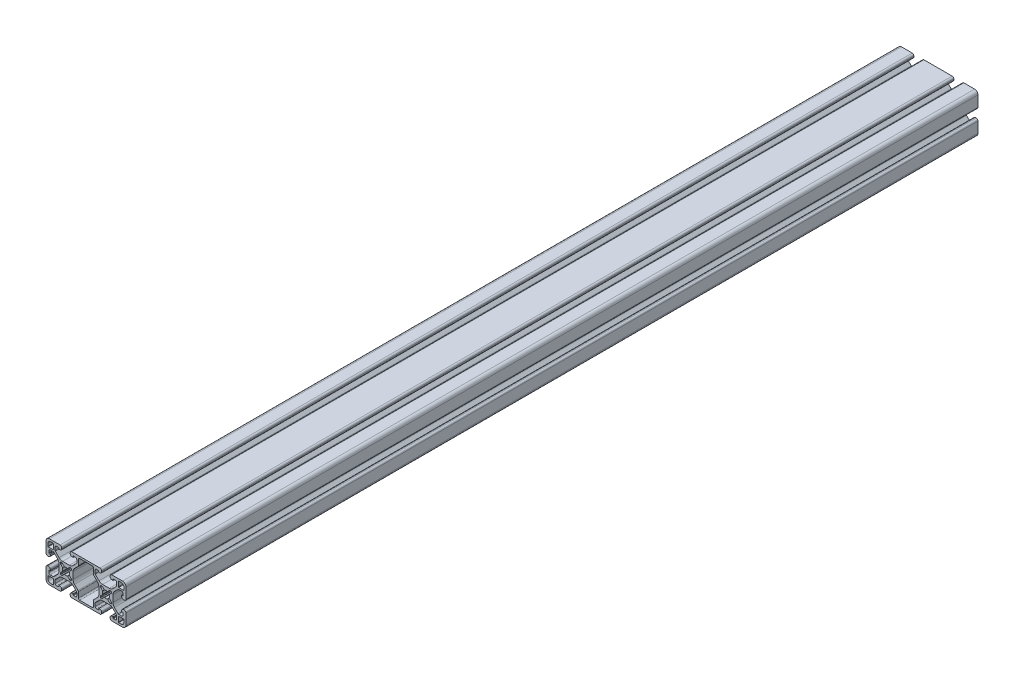
from build123d import *

# Parameters (mm, degrees)
EXTRUDE1_DEPTH     = 812.8
SKETCH2_R          = 3.75666
CUT_EXTRUDE1_DEPTH = 815.58397971


with BuildPart() as part:
    # Sketch1 → Extrude1 (new body)
    with BuildSketch(Plane.XY):
        with BuildLine():
            Line((35.335872595, -7.239), (35.335872595, -9.017))
            ThreePointArc((35.335872595, -9.017), (34.963898208, -9.915025612), (34.065872595, -10.287))
            Line((34.065872595, -10.287), (31.267800422, -10.287))
            ThreePointArc((31.267800422, -10.287), (30.927594851, -10.219328904), (30.639182494, -10.026617928))
            Line((30.639182494, -10.026617928), (27.179198975, -6.56663441))
            ThreePointArc((27.179198975, -6.56663441), (26.14957176, -5.025688387), (25.788014764, -3.20801862))
            Line((25.788014764, -3.20801862), (25.788014764, 3.20801862))
            ThreePointArc((25.788014764, 3.20801862), (26.14957176, 5.025688387), (27.179198975, 6.56663441))
            Line((27.179198975, 6.56663441), (30.639182494, 10.026617928))
            ThreePointArc((30.639182494, 10.026617928), (30.927594851, 10.219328904), (31.267800422, 10.287))
            Line((31.267800422, 10.287), (34.065872595, 10.287))
            ThreePointArc((34.065872595, 10.287), (34.963898208, 9.915025612), (35.335872595, 9.017))
            Line((35.335872595, 9.017), (35.335872595, 7.239))
            ThreePointArc((35.335872595, 7.239), (35.224280279, 6.969592316), (34.954872595, 6.858))
            Line((34.954872595, 6.858), (34.036, 6.858))
            Line((34.036, 6.858), (34.036, 5.6388))
            ThreePointArc((34.036, 5.6388), (34.497248241, 4.525248241), (35.6108, 4.064))
            Line((35.6108, 4.064), (36.5252, 4.064))
            ThreePointArc((36.5252, 4.064), (37.638751759, 4.525248241), (38.1, 5.6388))
            Line((38.1, 5.6388), (38.1, 15.875))
            ThreePointArc((38.1, 15.875), (37.17006403, 18.12006403), (34.925, 19.05))
            Line((34.925, 19.05), (24.6888, 19.05))
            ThreePointArc((24.6888, 19.05), (23.575248241, 18.588751759), (23.114, 17.4752))
            Line((23.114, 17.4752), (23.114, 16.5608))
            ThreePointArc((23.114, 16.5608), (23.575248241, 15.447248241), (24.6888, 14.986))
            Line((24.6888, 14.986), (25.908, 14.986))
            Line((25.908, 14.986), (25.908, 15.904872595))
            ThreePointArc((25.908, 15.904872595), (26.019592316, 16.174280279), (26.289, 16.285872595))
            Line((26.289, 16.285872595), (28.067, 16.285872595))
            ThreePointArc((28.067, 16.285872595), (28.965025612, 15.913898208), (29.337, 15.015872595))
            Line((29.337, 15.015872595), (29.337, 12.217800422))
            ThreePointArc((29.337, 12.217800422), (29.269328904, 11.877594851), (29.076617928, 11.589182494))
            Line((29.076617928, 11.589182494), (25.61663441, 8.129198975))
            ThreePointArc((25.61663441, 8.129198975), (24.075688387, 7.09957176), (22.25801862, 6.738014764))
            Line((22.25801862, 6.738014764), (15.84198138, 6.738014764))
            ThreePointArc((15.84198138, 6.738014764), (14.024311613, 7.09957176), (12.48336559, 8.129198975))
            Line((12.48336559, 8.129198975), (9.023382072, 11.589182494))
            ThreePointArc((9.023382072, 11.589182494), (8.830671096, 11.877594851), (8.763, 12.217800422))
            Line((8.763, 12.217800422), (8.763, 15.015872595))
            ThreePointArc((8.763, 15.015872595), (9.134974388, 15.913898208), (10.033, 16.285872595))
            Line((10.033, 16.285872595), (11.811, 16.285872595))
            ThreePointArc((11.811, 16.285872595), (12.080407684, 16.174280279), (12.192, 15.904872595))
            Line((12.192, 15.904872595), (12.192, 14.986))
            Line((12.192, 14.986), (13.4112, 14.986))
            ThreePointArc((13.4112, 14.986), (14.524751759, 15.447248241), (14.986, 16.5608))
            Line((14.986, 16.5608), (14.986, 17.4752))
            ThreePointArc((14.986, 17.4752), (14.524751759, 18.588751759), (13.4112, 19.05))
            Line((13.4112, 19.05), (-13.4112, 19.05))
            ThreePointArc((-13.4112, 19.05), (-14.524751759, 18.588751759), (-14.986, 17.4752))
            Line((-14.986, 17.4752), (-14.986, 16.5608))
            ThreePointArc((-14.986, 16.5608), (-14.524751759, 15.447248241), (-13.4112, 14.986))
            Line((-13.4112, 14.986), (-12.192, 14.986))
            Line((-12.192, 14.986), (-12.192, 15.904872595))
            ThreePointArc((-12.192, 15.904872595), (-12.080407684, 16.174280279), (-11.811, 16.285872595))
            Line((-11.811, 16.285872595), (-10.033, 16.285872595))
            ThreePointArc((-10.033, 16.285872595), (-9.134974388, 15.913898208), (-8.763, 15.015872595))
            Line((-8.763, 15.015872595), (-8.763, 12.217800422))
            ThreePointArc((-8.763, 12.217800422), (-8.830671096, 11.877594851), (-9.023382072, 11.589182494))
            Line((-9.023382072, 11.589182494), (-12.48336559, 8.129198975))
            ThreePointArc((-12.48336559, 8.129198975), (-14.024311613, 7.09957176), (-15.84198138, 6.738014764))
            Line((-15.84198138, 6.738014764), (-22.25801862, 6.738014764))
            ThreePointArc((-22.25801862, 6.738014764), (-24.075688387, 7.09957176), (-25.61663441, 8.129198975))
            Line((-25.61663441, 8.129198975), (-29.076617928, 11.589182494))
            ThreePointArc((-29.076617928, 11.589182494), (-29.269328904, 11.877594851), (-29.337, 12.217800422))
            Line((-29.337, 12.217800422), (-29.337, 15.015872595))
            ThreePointArc((-29.337, 15.015872595), (-28.965025612, 15.913898208), (-28.067, 16.285872595))
            Line((-28.067, 16.285872595), (-26.289, 16.285872595))
            ThreePointArc((-26.289, 16.285872595), (-26.019592316, 16.174280279), (-25.908, 15.904872595))
            Line((-25.908, 15.904872595), (-25.908, 14.986))
            Line((-25.908, 14.986), (-24.6888, 14.986))
            ThreePointArc((-24.6888, 14.986), (-23.575248241, 15.447248241), (-23.114, 16.5608))
            Line((-23.114, 16.5608), (-23.114, 17.4752))
            ThreePointArc((-23.114, 17.4752), (-23.575248241, 18.588751759), (-24.6888, 19.05))
            Line((-24.6888, 19.05), (-34.925, 19.05))
            ThreePointArc((-34.925, 19.05), (-37.17006403, 18.12006403), (-38.1, 15.875))
            Line((-38.1, 15.875), (-38.1, 5.6388))
            ThreePointArc((-38.1, 5.6388), (-37.638751759, 4.525248241), (-36.5252, 4.064))
            Line((-36.5252, 4.064), (-35.6108, 4.064))
            ThreePointArc((-35.6108, 4.064), (-34.497248241, 4.525248241), (-34.036, 5.6388))
            Line((-34.036, 5.6388), (-34.036, 6.858))
            Line((-34.036, 6.858), (-34.954872595, 6.858))
            ThreePointArc((-34.954872595, 6.858), (-35.224280279, 6.969592316), (-35.335872595, 7.239))
            Line((-35.335872595, 7.239), (-35.335872595, 9.017))
            ThreePointArc((-35.335872595, 9.017), (-34.963898208, 9.915025612), (-34.065872595, 10.287))
            Line((-34.065872595, 10.287), (-31.267800422, 10.287))
            ThreePointArc((-31.267800422, 10.287), (-30.927594851, 10.219328904), (-30.639182494, 10.026617928))
            Line((-30.639182494, 10.026617928), (-27.179198975, 6.56663441))
            ThreePointArc((-27.179198975, 6.56663441), (-26.14957176, 5.025688387), (-25.788014764, 3.20801862))
            Line((-25.788014764, 3.20801862), (-25.788014764, -3.20801862))
            ThreePointArc((-25.788014764, -3.20801862), (-26.14957176, -5.025688387), (-27.179198975, -6.56663441))
            Line((-27.179198975, -6.56663441), (-30.639182494, -10.026617928))
            ThreePointArc((-30.639182494, -10.026617928), (-30.927594851, -10.219328904), (-31.267800422, -10.287))
            Line((-31.267800422, -10.287), (-34.065872595, -10.287))
            ThreePointArc((-34.065872595, -10.287), (-34.963898208, -9.915025612), (-35.335872595, -9.017))
            Line((-35.335872595, -9.017), (-35.335872595, -7.239))
            ThreePointArc((-35.335872595, -7.239), (-35.224280279, -6.969592316), (-34.954872595, -6.858))
            Line((-34.954872595, -6.858), (-34.036, -6.858))
            Line((-34.036, -6.858), (-34.036, -5.6388))
            ThreePointArc((-34.036, -5.6388), (-34.497248241, -4.525248241), (-35.6108, -4.064))
            Line((-35.6108, -4.064), (-36.5252, -4.064))
            ThreePointArc((-36.5252, -4.064), (-37.638751759, -4.525248241), (-38.1, -5.6388))
            Line((-38.1, -5.6388), (-38.1, -15.875))
            ThreePointArc((-38.1, -15.875), (-37.17006403, -18.12006403), (-34.925, -19.05))
            Line((-34.925, -19.05), (-24.6888, -19.05))
            ThreePointArc((-24.6888, -19.05), (-23.575248241, -18.588751759), (-23.114, -17.4752))
            Line((-23.114, -17.4752), (-23.114, -16.5608))
            ThreePointArc((-23.114, -16.5608), (-23.575248241, -15.447248241), (-24.6888, -14.986))
            Line((-24.6888, -14.986), (-25.908, -14.986))
            Line((-25.908, -14.986), (-25.908, -15.904872595))
            ThreePointArc((-25.908, -15.904872595), (-26.019592316, -16.174280279), (-26.289, -16.285872595))
            Line((-26.289, -16.285872595), (-28.067, -16.285872595))
            ThreePointArc((-28.067, -16.285872595), (-28.965025612, -15.913898208), (-29.337, -15.015872595))
            Line((-29.337, -15.015872595), (-29.337, -12.217800422))
            ThreePointArc((-29.337, -12.217800422), (-29.269328904, -11.877594851), (-29.076617928, -11.589182494))
            Line((-29.076617928, -11.589182494), (-25.61663441, -8.129198975))
            ThreePointArc((-25.61663441, -8.129198975), (-24.075688387, -7.09957176), (-22.25801862, -6.738014764))
            Line((-22.25801862, -6.738014764), (-15.84198138, -6.738014764))
            ThreePointArc((-15.84198138, -6.738014764), (-14.024311613, -7.09957176), (-12.48336559, -8.129198975))
            Line((-12.48336559, -8.129198975), (-9.023382072, -11.589182494))
            ThreePointArc((-9.023382072, -11.589182494), (-8.830671096, -11.877594851), (-8.763, -12.217800422))
            Line((-8.763, -12.217800422), (-8.763, -15.015872595))
            ThreePointArc((-8.763, -15.015872595), (-9.134974388, -15.913898208), (-10.033, -16.285872595))
            Line((-10.033, -16.285872595), (-11.811, -16.285872595))
            ThreePointArc((-11.811, -16.285872595), (-12.080407684, -16.174280279), (-12.192, -15.904872595))
            Line((-12.192, -15.904872595), (-12.192, -14.986))
            Line((-12.192, -14.986), (-13.4112, -14.986))
            ThreePointArc((-13.4112, -14.986), (-14.524751759, -15.447248241), (-14.986, -16.5608))
            Line((-14.986, -16.5608), (-14.986, -17.4752))
            ThreePointArc((-14.986, -17.4752), (-14.524751759, -18.588751759), (-13.4112, -19.05))
            Line((-13.4112, -19.05), (13.4112, -19.05))
            ThreePointArc((13.4112, -19.05), (14.524751759, -18.588751759), (14.986, -17.4752))
            Line((14.986, -17.4752), (14.986, -16.5608))
            ThreePointArc((14.986, -16.5608), (14.524751759, -15.447248241), (13.4112, -14.986))
            Line((13.4112, -14.986), (12.192, -14.986))
            Line((12.192, -14.986), (12.192, -15.904872595))
            ThreePointArc((12.192, -15.904872595), (12.080407684, -16.174280279), (11.811, -16.285872595))
            Line((11.811, -16.285872595), (10.033, -16.285872595))
            ThreePointArc((10.033, -16.285872595), (9.134974388, -15.913898208), (8.763, -15.015872595))
            Line((8.763, -15.015872595), (8.763, -12.217800422))
            ThreePointArc((8.763, -12.217800422), (8.830671096, -11.877594851), (9.023382072, -11.589182494))
            Line((9.023382072, -11.589182494), (12.48336559, -8.129198975))
            ThreePointArc((12.48336559, -8.129198975), (14.024311613, -7.09957176), (15.84198138, -6.738014764))
            Line((15.84198138, -6.738014764), (22.25801862, -6.738014764))
            ThreePointArc((22.25801862, -6.738014764), (24.075688387, -7.09957176), (25.61663441, -8.129198975))
            Line((25.61663441, -8.129198975), (29.076617928, -11.589182494))
            ThreePointArc((29.076617928, -11.589182494), (29.269328904, -11.877594851), (29.337, -12.217800422))
            Line((29.337, -12.217800422), (29.337, -15.015872595))
            ThreePointArc((29.337, -15.015872595), (28.965025612, -15.913898208), (28.067, -16.285872595))
            Line((28.067, -16.285872595), (26.289, -16.285872595))
            ThreePointArc((26.289, -16.285872595), (26.019592316, -16.174280279), (25.908, -15.904872595))
            Line((25.908, -15.904872595), (25.908, -14.986))
            Line((25.908, -14.986), (24.6888, -14.986))
            ThreePointArc((24.6888, -14.986), (23.575248241, -15.447248241), (23.114, -16.5608))
            Line((23.114, -16.5608), (23.114, -17.4752))
            ThreePointArc((23.114, -17.4752), (23.575248241, -18.588751759), (24.6888, -19.05))
            Line((24.6888, -19.05), (34.925, -19.05))
            ThreePointArc((34.925, -19.05), (37.17006403, -18.12006403), (38.1, -15.875))
            Line((38.1, -15.875), (38.1, -5.6388))
            ThreePointArc((38.1, -5.6388), (37.638751759, -4.525248241), (36.5252, -4.064))
            Line((36.5252, -4.064), (35.6108, -4.064))
            ThreePointArc((35.6108, -4.064), (34.497248241, -4.525248241), (34.036, -5.6388))
            Line((34.036, -5.6388), (34.036, -6.858))
            Line((34.036, -6.858), (34.954872595, -6.858))
            ThreePointArc((34.954872595, -6.858), (35.224280279, -6.969592316), (35.335872595, -7.239))
        make_face()
        with BuildLine():
            Line((-20.632347442, -3.198793543), (-22.354771827, -4.921217928))
            ThreePointArc((-22.354771827, -4.921217928), (-22.643184184, -5.113928904), (-22.983389755, -5.1816))
            Line((-22.983389755, -5.1816), (-23.9776, -5.1816))
            ThreePointArc((-23.9776, -5.1816), (-24.157205122, -5.107205122), (-24.2316, -4.9276))
            Line((-24.2316, -4.9276), (-24.2316, -3.933389755))
            ThreePointArc((-24.2316, -3.933389755), (-24.163928904, -3.593184184), (-23.971217928, -3.304771827))
            Line((-23.971217928, -3.304771827), (-22.248793543, -1.582347442))
            ThreePointArc((-22.248793543, -1.582347442), (-22.145711236, -1.393016011), (-22.161879183, -1.178048687))
            ThreePointArc((-22.161879183, -1.178048687), (-22.3774, 0), (-22.161879183, 1.178048687))
            ThreePointArc((-22.161879183, 1.178048687), (-22.145711236, 1.393016011), (-22.248793543, 1.582347442))
            Line((-22.248793543, 1.582347442), (-23.971217928, 3.304771827))
            ThreePointArc((-23.971217928, 3.304771827), (-24.163928904, 3.593184184), (-24.2316, 3.933389755))
            Line((-24.2316, 3.933389755), (-24.2316, 4.9276))
            ThreePointArc((-24.2316, 4.9276), (-24.157205122, 5.107205122), (-23.9776, 5.1816))
            Line((-23.9776, 5.1816), (-22.983389755, 5.1816))
            ThreePointArc((-22.983389755, 5.1816), (-22.643184184, 5.113928904), (-22.354771827, 4.921217928))
            Line((-22.354771827, 4.921217928), (-20.632347442, 3.198793543))
            ThreePointArc((-20.632347442, 3.198793543), (-20.443016011, 3.095711236), (-20.228048687, 3.111879183))
            ThreePointArc((-20.228048687, 3.111879183), (-19.05, 3.3274), (-17.871951313, 3.111879183))
            ThreePointArc((-17.871951313, 3.111879183), (-17.656983989, 3.095711236), (-17.467652558, 3.198793543))
            Line((-17.467652558, 3.198793543), (-15.745228173, 4.921217928))
            ThreePointArc((-15.745228173, 4.921217928), (-15.456815816, 5.113928904), (-15.116610245, 5.1816))
            Line((-15.116610245, 5.1816), (-14.1224, 5.1816))
            ThreePointArc((-14.1224, 5.1816), (-13.942794878, 5.107205122), (-13.8684, 4.9276))
            Line((-13.8684, 4.9276), (-13.8684, 3.933389755))
            ThreePointArc((-13.8684, 3.933389755), (-13.936071096, 3.593184184), (-14.128782072, 3.304771827))
            Line((-14.128782072, 3.304771827), (-15.851206457, 1.582347442))
            ThreePointArc((-15.851206457, 1.582347442), (-15.954288764, 1.393016011), (-15.938120817, 1.178048687))
            ThreePointArc((-15.938120817, 1.178048687), (-15.7226, 0), (-15.938120817, -1.178048687))
            ThreePointArc((-15.938120817, -1.178048687), (-15.954288764, -1.393016011), (-15.851206457, -1.582347442))
            Line((-15.851206457, -1.582347442), (-14.128782072, -3.304771827))
            ThreePointArc((-14.128782072, -3.304771827), (-13.936071096, -3.593184184), (-13.8684, -3.933389755))
            Line((-13.8684, -3.933389755), (-13.8684, -4.9276))
            ThreePointArc((-13.8684, -4.9276), (-13.942794878, -5.107205122), (-14.1224, -5.1816))
            Line((-14.1224, -5.1816), (-15.116610245, -5.1816))
            ThreePointArc((-15.116610245, -5.1816), (-15.456815816, -5.113928904), (-15.745228173, -4.921217928))
            Line((-15.745228173, -4.921217928), (-17.467652558, -3.198793543))
            ThreePointArc((-17.467652558, -3.198793543), (-17.656983989, -3.095711236), (-17.871951313, -3.111879183))
            ThreePointArc((-17.871951313, -3.111879183), (-19.05, -3.3274), (-20.228048687, -3.111879183))
            ThreePointArc((-20.228048687, -3.111879183), (-20.443016011, -3.095711236), (-20.632347442, -3.198793543))
        make_face(mode=Mode.SUBTRACT)
        with BuildLine():
            Line((30.9118, -16.8656), (30.9118, -12.2428))
            ThreePointArc((30.9118, -12.2428), (31.023392316, -11.973392316), (31.2928, -11.8618))
            Line((31.2928, -11.8618), (35.9156, -11.8618))
            ThreePointArc((35.9156, -11.8618), (36.185007684, -11.973392316), (36.2966, -12.2428))
            Line((36.2966, -12.2428), (36.2966, -14.4526))
            ThreePointArc((36.2966, -14.4526), (35.478256347, -16.428256347), (33.5026, -17.2466))
            Line((33.5026, -17.2466), (31.2928, -17.2466))
            ThreePointArc((31.2928, -17.2466), (31.023392316, -17.135007684), (30.9118, -16.8656))
        make_face(mode=Mode.SUBTRACT)
        with BuildLine():
            Line((35.9156, 11.8618), (31.2928, 11.8618))
            ThreePointArc((31.2928, 11.8618), (31.023392316, 11.973392316), (30.9118, 12.2428))
            Line((30.9118, 12.2428), (30.9118, 16.8656))
            ThreePointArc((30.9118, 16.8656), (31.023392316, 17.135007684), (31.2928, 17.2466))
            Line((31.2928, 17.2466), (33.5026, 17.2466))
            ThreePointArc((33.5026, 17.2466), (35.478256347, 16.428256347), (36.2966, 14.4526))
            Line((36.2966, 14.4526), (36.2966, 12.2428))
            ThreePointArc((36.2966, 12.2428), (36.185007684, 11.973392316), (35.9156, 11.8618))
        make_face(mode=Mode.SUBTRACT)
        with BuildLine():
            Line((5.9182, -17.2466), (-5.9182, -17.2466))
            ThreePointArc((-5.9182, -17.2466), (-6.816225612, -16.874625612), (-7.1882, -15.9766))
            Line((-7.1882, -15.9766), (-7.1882, -10.825286659))
            ThreePointArc((-7.1882, -10.825286659), (-7.284872994, -10.3392787), (-7.560174388, -9.927261047))
            Line((-7.560174388, -9.927261047), (-10.920801025, -6.56663441))
            ThreePointArc((-10.920801025, -6.56663441), (-11.95042824, -5.025688387), (-12.311985236, -3.20801862))
            Line((-12.311985236, -3.20801862), (-12.311985236, 3.20801862))
            ThreePointArc((-12.311985236, 3.20801862), (-11.95042824, 5.025688387), (-10.920801025, 6.56663441))
            Line((-10.920801025, 6.56663441), (-7.560174388, 9.927261047))
            ThreePointArc((-7.560174388, 9.927261047), (-7.284872994, 10.3392787), (-7.1882, 10.825286659))
            Line((-7.1882, 10.825286659), (-7.1882, 15.9766))
            ThreePointArc((-7.1882, 15.9766), (-6.816225612, 16.874625612), (-5.9182, 17.2466))
            Line((-5.9182, 17.2466), (5.9182, 17.2466))
            ThreePointArc((5.9182, 17.2466), (6.816225612, 16.874625612), (7.1882, 15.9766))
            Line((7.1882, 15.9766), (7.1882, 10.825286659))
            ThreePointArc((7.1882, 10.825286659), (7.284872994, 10.3392787), (7.560174388, 9.927261047))
            Line((7.560174388, 9.927261047), (10.920801025, 6.56663441))
            ThreePointArc((10.920801025, 6.56663441), (11.95042824, 5.025688387), (12.311985236, 3.20801862))
            Line((12.311985236, 3.20801862), (12.311985236, -3.20801862))
            ThreePointArc((12.311985236, -3.20801862), (11.95042824, -5.025688387), (10.920801025, -6.56663441))
            Line((10.920801025, -6.56663441), (7.560174388, -9.927261047))
            ThreePointArc((7.560174388, -9.927261047), (7.284872994, -10.3392787), (7.1882, -10.825286659))
            Line((7.1882, -10.825286659), (7.1882, -15.9766))
            ThreePointArc((7.1882, -15.9766), (6.816225612, -16.874625612), (5.9182, -17.2466))
        make_face(mode=Mode.SUBTRACT)
        with BuildLine():
            Line((17.467652558, -3.198793543), (15.745228173, -4.921217928))
            ThreePointArc((15.745228173, -4.921217928), (15.456815816, -5.113928904), (15.116610245, -5.1816))
            Line((15.116610245, -5.1816), (14.1224, -5.1816))
            ThreePointArc((14.1224, -5.1816), (13.942794878, -5.107205122), (13.8684, -4.9276))
            Line((13.8684, -4.9276), (13.8684, -3.933389755))
            ThreePointArc((13.8684, -3.933389755), (13.936071096, -3.593184184), (14.128782072, -3.304771827))
            Line((14.128782072, -3.304771827), (15.851206457, -1.582347442))
            ThreePointArc((15.851206457, -1.582347442), (15.954288764, -1.393016011), (15.938120817, -1.178048687))
            ThreePointArc((15.938120817, -1.178048687), (15.7226, 0), (15.938120817, 1.178048687))
            ThreePointArc((15.938120817, 1.178048687), (15.954288764, 1.393016011), (15.851206457, 1.582347442))
            Line((15.851206457, 1.582347442), (14.128782072, 3.304771827))
            ThreePointArc((14.128782072, 3.304771827), (13.936071096, 3.593184184), (13.8684, 3.933389755))
            Line((13.8684, 3.933389755), (13.8684, 4.9276))
            ThreePointArc((13.8684, 4.9276), (13.942794878, 5.107205122), (14.1224, 5.1816))
            Line((14.1224, 5.1816), (15.116610245, 5.1816))
            ThreePointArc((15.116610245, 5.1816), (15.456815816, 5.113928904), (15.745228173, 4.921217928))
            Line((15.745228173, 4.921217928), (17.467652558, 3.198793543))
            ThreePointArc((17.467652558, 3.198793543), (17.656983989, 3.095711236), (17.871951313, 3.111879183))
            ThreePointArc((17.871951313, 3.111879183), (19.05, 3.3274), (20.228048687, 3.111879183))
            ThreePointArc((20.228048687, 3.111879183), (20.443016011, 3.095711236), (20.632347442, 3.198793543))
            Line((20.632347442, 3.198793543), (22.354771827, 4.921217928))
            ThreePointArc((22.354771827, 4.921217928), (22.643184184, 5.113928904), (22.983389755, 5.1816))
            Line((22.983389755, 5.1816), (23.9776, 5.1816))
            ThreePointArc((23.9776, 5.1816), (24.157205122, 5.107205122), (24.2316, 4.9276))
            Line((24.2316, 4.9276), (24.2316, 3.933389755))
            ThreePointArc((24.2316, 3.933389755), (24.163928904, 3.593184184), (23.971217928, 3.304771827))
            Line((23.971217928, 3.304771827), (22.248793543, 1.582347442))
            ThreePointArc((22.248793543, 1.582347442), (22.145711236, 1.393016011), (22.161879183, 1.178048687))
            ThreePointArc((22.161879183, 1.178048687), (22.3774, 0), (22.161879183, -1.178048687))
            ThreePointArc((22.161879183, -1.178048687), (22.145711236, -1.393016011), (22.248793543, -1.582347442))
            Line((22.248793543, -1.582347442), (23.971217928, -3.304771827))
            ThreePointArc((23.971217928, -3.304771827), (24.163928904, -3.593184184), (24.2316, -3.933389755))
            Line((24.2316, -3.933389755), (24.2316, -4.9276))
            ThreePointArc((24.2316, -4.9276), (24.157205122, -5.107205122), (23.9776, -5.1816))
            Line((23.9776, -5.1816), (22.983389755, -5.1816))
            ThreePointArc((22.983389755, -5.1816), (22.643184184, -5.113928904), (22.354771827, -4.921217928))
            Line((22.354771827, -4.921217928), (20.632347442, -3.198793543))
            ThreePointArc((20.632347442, -3.198793543), (20.443016011, -3.095711236), (20.228048687, -3.111879183))
            ThreePointArc((20.228048687, -3.111879183), (19.05, -3.3274), (17.871951313, -3.111879183))
            ThreePointArc((17.871951313, -3.111879183), (17.656983989, -3.095711236), (17.467652558, -3.198793543))
        make_face(mode=Mode.SUBTRACT)
        with BuildLine():
            Line((-35.9156, -11.8618), (-31.2928, -11.8618))
            ThreePointArc((-31.2928, -11.8618), (-31.023392316, -11.973392316), (-30.9118, -12.2428))
            Line((-30.9118, -12.2428), (-30.9118, -16.8656))
            ThreePointArc((-30.9118, -16.8656), (-31.023392316, -17.135007684), (-31.2928, -17.2466))
            Line((-31.2928, -17.2466), (-33.5026, -17.2466))
            ThreePointArc((-33.5026, -17.2466), (-35.478256347, -16.428256347), (-36.2966, -14.4526))
            Line((-36.2966, -14.4526), (-36.2966, -12.2428))
            ThreePointArc((-36.2966, -12.2428), (-36.185007684, -11.973392316), (-35.9156, -11.8618))
        make_face(mode=Mode.SUBTRACT)
        with BuildLine():
            Line((-30.9118, 16.8656), (-30.9118, 12.2428))
            ThreePointArc((-30.9118, 12.2428), (-31.023392316, 11.973392316), (-31.2928, 11.8618))
            Line((-31.2928, 11.8618), (-35.9156, 11.8618))
            ThreePointArc((-35.9156, 11.8618), (-36.185007684, 11.973392316), (-36.2966, 12.2428))
            Line((-36.2966, 12.2428), (-36.2966, 14.4526))
            ThreePointArc((-36.2966, 14.4526), (-35.478256347, 16.428256347), (-33.5026, 17.2466))
            Line((-33.5026, 17.2466), (-31.2928, 17.2466))
            ThreePointArc((-31.2928, 17.2466), (-31.023392316, 17.135007684), (-30.9118, 16.8656))
        make_face(mode=Mode.SUBTRACT)
    extrude(amount=-EXTRUDE1_DEPTH)

    # Sketch2 → Cut-Extrude1 (cut, through all)
    with BuildSketch(Plane(origin=(0, 19.05, 0), x_dir=(1, 0, 0), z_dir=(0, 1, 0))):
        with Locations(Location((-19.05, 577.85, 0), (0, 0, 251.72432295))):
            Circle(SKETCH2_R)
    extrude(amount=-CUT_EXTRUDE1_DEPTH, mode=Mode.SUBTRACT)


solid = part.part
